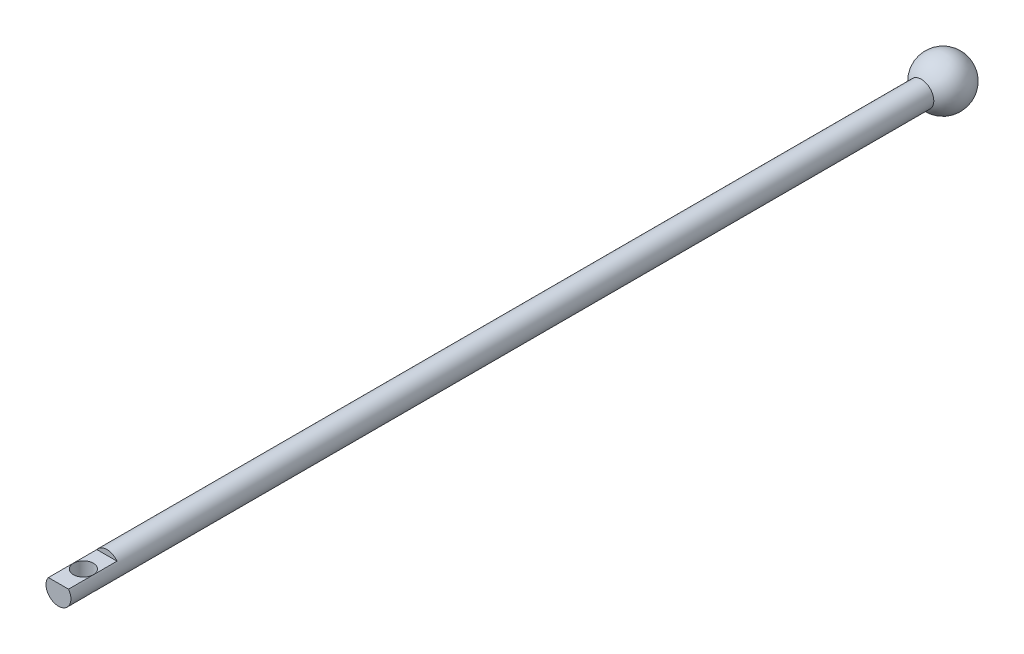
from build123d import *

# Parameters (mm, degrees)
SKETCH1_R           = 1
BOSS_EXTRUDE1_DEPTH = 70
SKETCH3_W           = 4.158474465
SKETCH3_H           = 4.275067207
CUT_EXTRUDE1_DEPTH  = 1
SKETCH4_R           = 0.8
CUT_EXTRUDE2_DEPTH  = 4


with BuildPart() as part:
    # Sketch1 → Boss-Extrude1 (new body)
    with BuildSketch(Plane.XY):
        with Locations((-6.504393421, -0.589738754)):
            Circle(SKETCH1_R)
    extrude(amount=BOSS_EXTRUDE1_DEPTH)

    # Sketch2 → Revolve1 (revolve)
    with BuildSketch(Plane(origin=(0, 0, -1), x_dir=(-1, 0, 0), z_dir=(0, 0, -1))):
        with BuildLine():
            Line((6.504393421, 1.410261246), (6.504393421, -2.589738754))
            ThreePointArc((6.504393421, -2.589738754), (4.504393421, -0.589738754), (6.504393421, 1.410261246))
        make_face()
    revolve(axis=Axis((-6.504393421, 2.047627036, -1), (0, -1, 0)))

    # Sketch3 → Cut-Extrude1 (cut)
    with BuildSketch(Plane(origin=(0, 0, 0), x_dir=(1, 0, 0), z_dir=(0, 1, 0))):
        with Locations((-6.409968211, -68.247716877)):
            Rectangle(SKETCH3_W, SKETCH3_H)
    extrude(amount=CUT_EXTRUDE1_DEPTH, mode=Mode.SUBTRACT)

    # Sketch4 → Cut-Extrude2 (cut)
    with BuildSketch(Plane(origin=(0, 0, 0), x_dir=(1, 0, 0), z_dir=(0, 1, 0))):
        with Locations(Location((-6.504393421, -68, 0), (0, 0, 270))):
            Circle(SKETCH4_R)
    extrude(amount=-CUT_EXTRUDE2_DEPTH, mode=Mode.SUBTRACT)


solid = part.part
